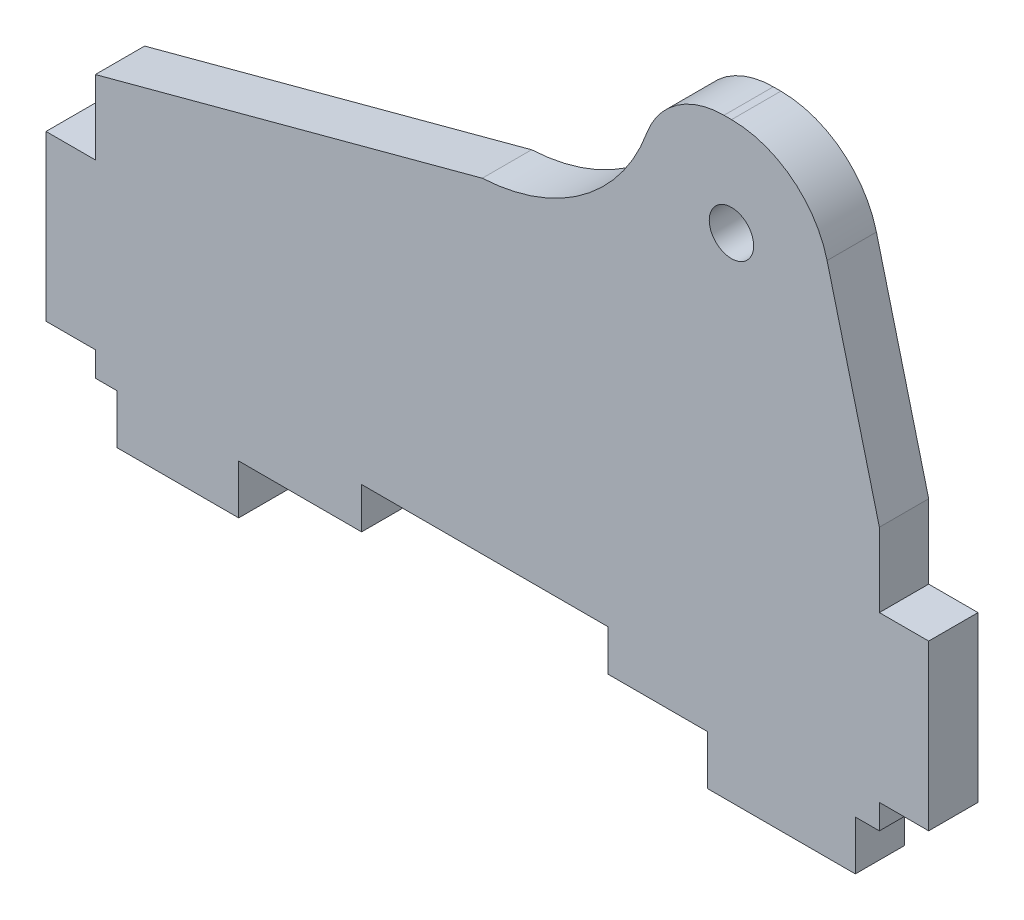
from build123d import *

# Parameters (mm, degrees)
SKETCH_1_R      = 1.35
EXTRUDE_1_DEPTH = 3


with BuildPart() as part:
    # 草图1 → 凸台-拉伸1 (new body)
    with BuildSketch(Plane(origin=(0, 0, 0), x_dir=(-1, 0, 0), z_dir=(0, 0, -1))):
        with BuildLine():
            Line((-41.246222879, 31.4756), (-41.70566582, 31.4756))
            ThreePointArc((-41.70566582, 31.4756), (-45.386541118, 30.213865193), (-47.519320255, 26.959319012))
            Line((-47.519320255, 26.959319012), (-50.6992, 14.4996))
            Line((-50.6992, 14.4996), (-50.6992, 10.0003))
            Line((-50.6992, 10.0003), (-53.6992, 10.0003))
            Line((-53.6992, 10.0003), (-53.6992, 0))
            Line((-53.6992, 0), (-50.6992, 0))
            Line((-50.6992, 0), (-50.6992, -1.5007))
            Line((-50.6992, -1.5007), (-49.2382, -1.5007))
            Line((-49.2382, -1.5007), (-49.2382, -4.5007))
            Line((-49.2382, -4.5007), (-40.2392, -4.5007))
            Line((-40.2392, -4.5007), (-40.2392, -1.4993))
            Line((-40.2392, -1.4993), (-34.2002, -1.4993))
            Line((-34.2002, -1.4993), (-34.2002, 1.0005))
            Line((-34.2002, 1.0005), (-19.2003, 1.0005))
            Line((-19.2003, 1.0005), (-19.2003, -1.4993))
            Line((-19.2003, -1.4993), (-11.7217, -1.4993))
            Line((-11.7217, -1.4993), (-11.7217, -4.5007))
            Line((-11.7217, -4.5007), (-4.3215, -4.5007))
            Line((-4.3215, -4.5007), (-4.3215, -1.5007))
            Line((-4.3215, -1.5007), (-3, -1.5007))
            Line((-3, -1.5007), (-3, 0))
            Line((-3, 0), (0, 0))
            Line((0, 0), (0, 10.0003))
            Line((0, 10.0003), (-3, 10.0003))
            Line((-3, 10.0003), (-3, 14.4996))
            Line((-3, 14.4996), (-26.543543046, 20.807804388))
            ThreePointArc((-26.543543046, 20.807804388), (-32.65852857, 22.990550509), (-36.548909006, 28.188854909))
            ThreePointArc((-36.548909006, 28.188854909), (-38.379715818, 30.572322748), (-41.246222879, 31.4756))
        make_face()
        with Locations((-41.6992, 25.49975)):
            Circle(SKETCH_1_R, mode=Mode.SUBTRACT)
    extrude(amount=-EXTRUDE_1_DEPTH)


solid = part.part
